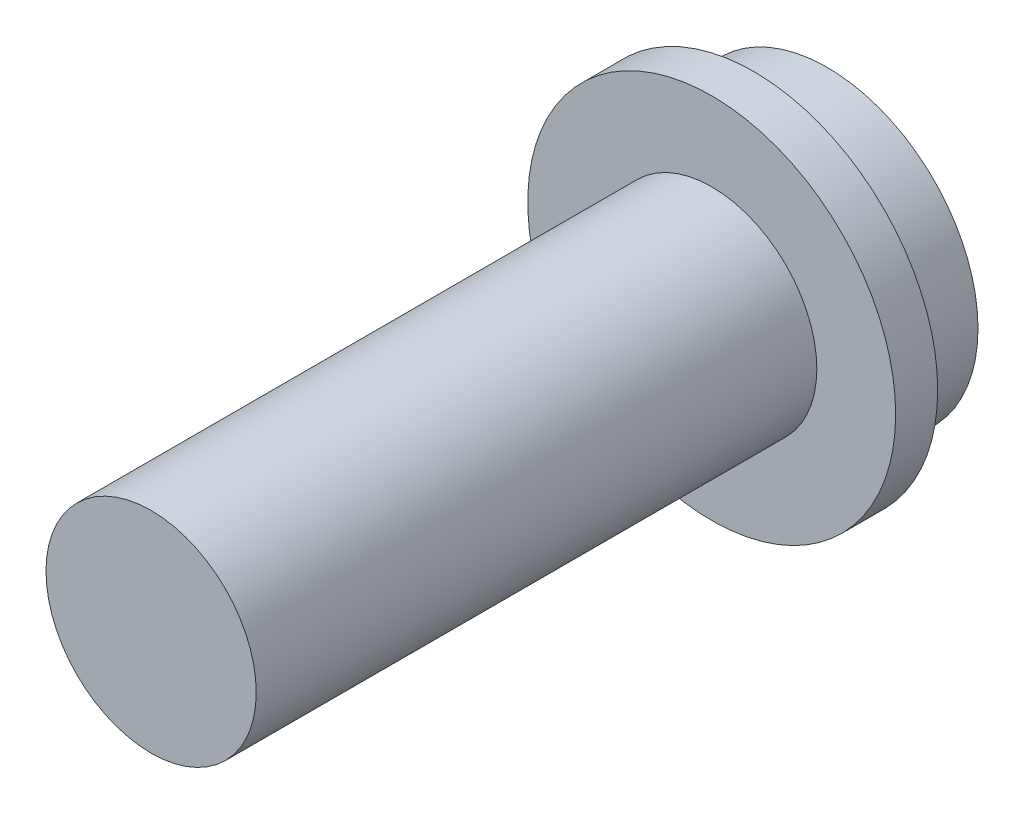
from build123d import *

# Parameters (mm, degrees)
S01_M6_THREADED_SHANK_R                  = 3
F_01_M6_THREADED_SHANK_DEPTH             = 16
F_02_START                               = -1.2
S02_BUTTON_HEAD_CLEARING_DIAMETER_R      = 5.25
F_02_BUTTON_HEAD_CLEARING_DIAMETER_DEPTH = 1.2
F_03_START                               = -3.3
S03_BUTTON_CROWN_R                       = 4.3
F_03_BUTTON_CROWN_DEPTH                  = 2.1
F_04_START                               = -3.4
F_04_4_MM_HEX_SOCKET_DEPTH               = 2.2


with BuildPart() as part:
    # S01 - M6 threaded shank → 01 - M6 threaded shank (new body)
    with BuildSketch(Plane.XY):
        Circle(S01_M6_THREADED_SHANK_R)
    extrude(amount=F_01_M6_THREADED_SHANK_DEPTH)

    # S02 - Button head clearing diameter → 02 - Button head clearing diameter (add)
    with BuildSketch(Plane.XY.offset(F_02_START)):
        Circle(S02_BUTTON_HEAD_CLEARING_DIAMETER_R)
    extrude(amount=F_02_BUTTON_HEAD_CLEARING_DIAMETER_DEPTH)

    # S03 - Button crown → 03 - Button crown (add)
    with BuildSketch(Plane.XY.offset(F_03_START)):
        Circle(S03_BUTTON_CROWN_R)
    extrude(amount=F_03_BUTTON_CROWN_DEPTH)

    # S04 - 4 mm hex socket → 04 - 4 mm hex socket (cut)
    with BuildSketch(Plane.XY.offset(F_04_START)):
        Polygon((2.309401077, 0), (1.154700538, 2), (-1.154700538, 2), (-2.309401077, 0), (-1.154700538, -2), (1.154700538, -2), align=None)
    extrude(amount=F_04_4_MM_HEX_SOCKET_DEPTH, mode=Mode.SUBTRACT)


solid = part.part
